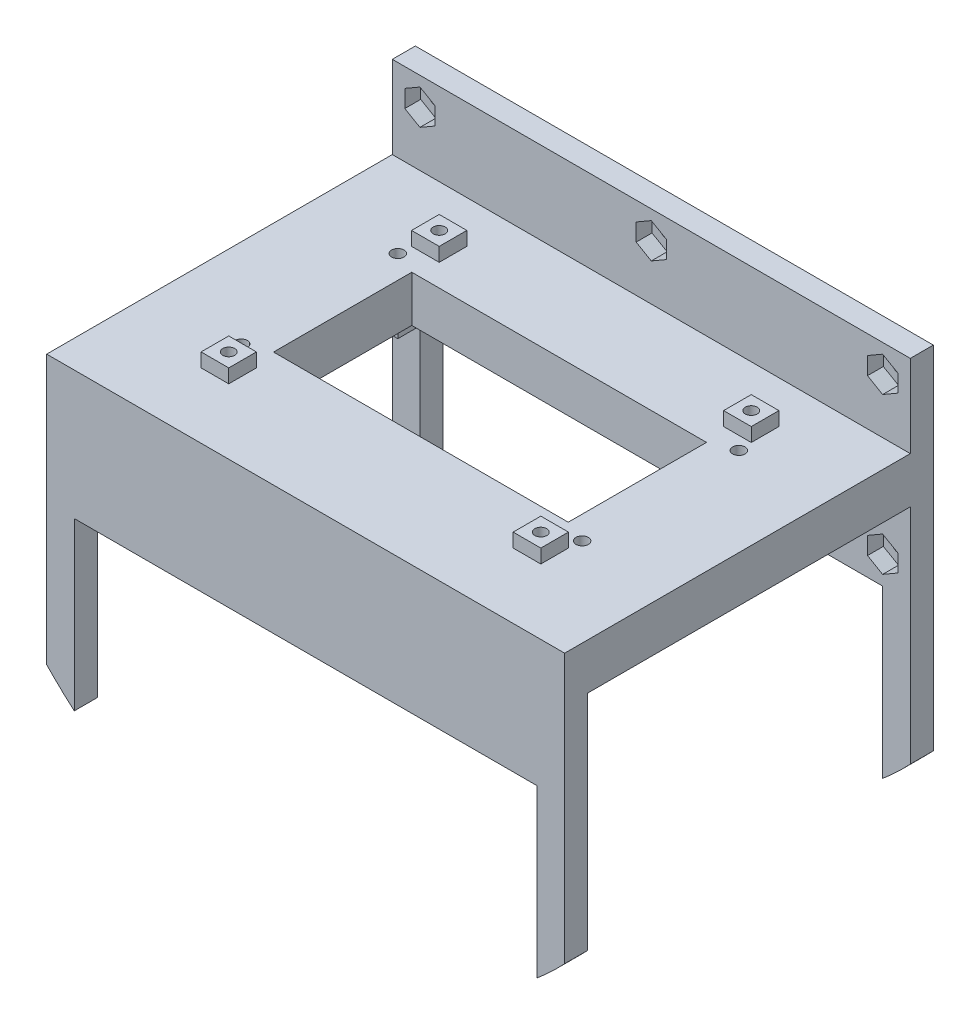
from build123d import *

# Parameters (mm, degrees)
SKETCH1_R               = 1.89865
BOSS_EXTRUDE1_DEPTH     = 6.35
SKETCH2_W               = 142.748
SKETCH2_H               = 12.7
BOSS_EXTRUDE2_DEPTH     = 88.9
SKETCH3_W               = 7.62
SKETCH3_H               = 7.62
SKETCH3_R               = 1.69999914
BOSS_EXTRUDE3_DEPTH     = 3.81
CUT_EXTRUDE2_REACH      = 139.396
SKETCH4_R               = 1.69999914
SKETCH4_W               = 81.221287992
SKETCH4_H               = 38.1
SKETCH5_W               = 7.62
SKETCH5_H               = 7.62
SKETCH5_R               = 1.65
BOSS_EXTRUDE4_DEPTH     = 3.81
BOSS_EXTRUDE5_DEPTH     = 6.35
CUT_EXTRUDE3_DEPTH      = 149.43301976
CUT_EXTRUDE3_DEPTH_BACK = 149.43301976
SKETCH9_R               = 1.65
CUT_EXTRUDE4_DEPTH      = 4.365625


with BuildPart() as part:
    # Sketch1 → Boss-Extrude1 (new body)
    with BuildSketch(Plane.XY):
        with BuildLine():
            Line((-71.374, -29.0845), (-71.374, -67.773392633))
            ThreePointArc((-71.374, -67.773392633), (-67.660178189, -71.481332615), (-63.754, -74.986052763))
            Line((-63.754, -74.986052763), (-63.754, -29.0845))
            Line((-63.754, -29.0845), (63.754, -29.0845))
            Line((63.754, -29.0845), (63.754, -74.986052763))
            ThreePointArc((63.754, -74.986052763), (67.660178189, -71.481332615), (71.374, -67.773392633))
            Line((71.374, -67.773392633), (71.374, -29.0845))
            Line((71.374, -29.0845), (71.374, 29.0845))
            Line((71.374, 29.0845), (-71.374, 29.0845))
            Line((-71.374, 29.0845), (-71.374, -29.0845))
        make_face()
        with Locations((-63.754, 21.4645)):
            Circle(SKETCH1_R, mode=Mode.SUBTRACT)
        with Locations((0, 21.4645)):
            Circle(SKETCH1_R, mode=Mode.SUBTRACT)
        with Locations((63.754, 21.4645)):
            Circle(SKETCH1_R, mode=Mode.SUBTRACT)
        with Locations((63.754, -21.4645)):
            Circle(SKETCH1_R, mode=Mode.SUBTRACT)
        with Locations((0, -21.4645)):
            Circle(SKETCH1_R, mode=Mode.SUBTRACT)
        with Locations((-63.754, -21.4645)):
            Circle(SKETCH1_R, mode=Mode.SUBTRACT)
    extrude(amount=BOSS_EXTRUDE1_DEPTH)

    # Sketch2 → Boss-Extrude2 (add)
    with BuildSketch(Plane.XY.offset(6.35)):
        Rectangle(SKETCH2_W, SKETCH2_H)
    extrude(amount=BOSS_EXTRUDE2_DEPTH)

    # Sketch3 → Boss-Extrude3 (add)
    # profile 1 of 4: a face of its own
    with BuildSketch(Plane.XZ.offset(6.35)):
        with Locations((-46.99, 72.39)):
            Rectangle(SKETCH3_W, SKETCH3_H)
        with Locations(Location((-46.99, 72.39, 0), (0, 0, 90))):
            Circle(SKETCH3_R, mode=Mode.SUBTRACT)
    # profile 2 of 4: a face of its own
    with BuildSketch(Plane.XZ.offset(6.35)):
        with Locations((46.99, 72.39)):
            Rectangle(SKETCH3_W, SKETCH3_H)
        with Locations(Location((46.99, 72.39, 0), (0, 0, 90))):
            Circle(SKETCH3_R, mode=Mode.SUBTRACT)
    # profile 3 of 4: a face of its own
    with BuildSketch(Plane.XZ.offset(6.35)):
        with Locations((46.99, 29.21)):
            Rectangle(SKETCH3_W, SKETCH3_H)
        with Locations(Location((46.99, 29.21, 0), (0, 0, 90))):
            Circle(SKETCH3_R, mode=Mode.SUBTRACT)
    # profile 4 of 4: a face of its own
    with BuildSketch(Plane.XZ.offset(6.35)):
        with Locations((-46.99, 29.21)):
            Rectangle(SKETCH3_W, SKETCH3_H)
        with Locations(Location((-46.99, 29.21, 0), (0, 0, 90))):
            Circle(SKETCH3_R, mode=Mode.SUBTRACT)
    extrude(amount=BOSS_EXTRUDE3_DEPTH)

    # Sketch4 → Cut-Extrude2 (cut, up to next)
    with BuildSketch(Plane.XZ.offset(6.35), mode=Mode.PRIVATE) as cut_extrude2_sk1:
        with Locations(Location((-46.99, 29.21, 0), (0, 0, 90))):
            Circle(SKETCH4_R)
    cut_extrude2_tool1 = extrude(cut_extrude2_sk1.sketch, amount=-CUT_EXTRUDE2_REACH, mode=Mode.PRIVATE) & part.part
    # Sketch4 → Cut-Extrude2 (cut, up to next)
    with BuildSketch(Plane.XZ.offset(6.35), mode=Mode.PRIVATE) as cut_extrude2_sk2:
        with Locations(Location((-46.99, 72.39, 0), (0, 0, 90))):
            Circle(SKETCH4_R)
    cut_extrude2_tool2 = extrude(cut_extrude2_sk2.sketch, amount=-CUT_EXTRUDE2_REACH, mode=Mode.PRIVATE) & part.part
    # Sketch4 → Cut-Extrude2 (cut, up to next)
    with BuildSketch(Plane.XZ.offset(6.35), mode=Mode.PRIVATE) as cut_extrude2_sk3:
        with Locations(Location((46.99, 29.21, 0), (0, 0, 90))):
            Circle(SKETCH4_R)
    cut_extrude2_tool3 = extrude(cut_extrude2_sk3.sketch, amount=-CUT_EXTRUDE2_REACH, mode=Mode.PRIVATE) & part.part
    # Sketch4 → Cut-Extrude2 (cut, up to next)
    with BuildSketch(Plane.XZ.offset(6.35), mode=Mode.PRIVATE) as cut_extrude2_sk4:
        with Locations(Location((46.99, 72.39, 0), (0, 0, 90))):
            Circle(SKETCH4_R)
    cut_extrude2_tool4 = extrude(cut_extrude2_sk4.sketch, amount=-CUT_EXTRUDE2_REACH, mode=Mode.PRIVATE) & part.part
    # Sketch4 → Cut-Extrude2 (cut, up to next)
    with BuildSketch(Plane.XZ.offset(6.35), mode=Mode.PRIVATE) as cut_extrude2_sk5:
        with Locations((0, 50.8)):
            Rectangle(SKETCH4_W, SKETCH4_H)
    cut_extrude2_tool5 = extrude(cut_extrude2_sk5.sketch, amount=-CUT_EXTRUDE2_REACH, mode=Mode.PRIVATE) & part.part
    add(cut_extrude2_tool1.solids().sort_by_distance((-46.99, -6.35, 29.21))[0], mode=Mode.SUBTRACT)
    add(cut_extrude2_tool2.solids().sort_by_distance((-46.99, -6.35, 72.39))[0], mode=Mode.SUBTRACT)
    add(cut_extrude2_tool3.solids().sort_by_distance((46.99, -6.35, 29.21))[0], mode=Mode.SUBTRACT)
    add(cut_extrude2_tool4.solids().sort_by_distance((46.99, -6.35, 72.39))[0], mode=Mode.SUBTRACT)
    add(cut_extrude2_tool5.solids().sort_by_distance((0, -6.35, 50.8))[0], mode=Mode.SUBTRACT)

    # Sketch5 → Boss-Extrude4 (add)
    # profile 1 of 4: a face of its own
    with BuildSketch(Plane(origin=(0, 6.35, 0), x_dir=(1, 0, 0), z_dir=(0, 1, 0))):
        with Locations((-43, -21.8)):
            Rectangle(SKETCH5_W, SKETCH5_H)
        with Locations(Location((-43, -21.8, 0), (0, 0, 90))):
            Circle(SKETCH5_R, mode=Mode.SUBTRACT)
    # profile 2 of 4: a face of its own
    with BuildSketch(Plane(origin=(0, 6.35, 0), x_dir=(1, 0, 0), z_dir=(0, 1, 0))):
        with Locations((43, -21.8)):
            Rectangle(SKETCH5_W, SKETCH5_H)
        with Locations(Location((43, -21.8, 0), (0, 0, 90))):
            Circle(SKETCH5_R, mode=Mode.SUBTRACT)
    # profile 3 of 4: a face of its own
    with BuildSketch(Plane(origin=(0, 6.35, 0), x_dir=(1, 0, 0), z_dir=(0, 1, 0))):
        with Locations((43, -79.8)):
            Rectangle(SKETCH5_W, SKETCH5_H)
        with Locations(Location((43, -79.8, 0), (0, 0, 90))):
            Circle(SKETCH5_R, mode=Mode.SUBTRACT)
    # profile 4 of 4: a face of its own
    with BuildSketch(Plane(origin=(0, 6.35, 0), x_dir=(1, 0, 0), z_dir=(0, 1, 0))):
        with Locations((-43, -79.8)):
            Rectangle(SKETCH5_W, SKETCH5_H)
        with Locations(Location((-43, -79.8, 0), (0, 0, 90))):
            Circle(SKETCH5_R, mode=Mode.SUBTRACT)
    extrude(amount=BOSS_EXTRUDE4_DEPTH)

    # Sketch6 → Boss-Extrude5 (add)
    with BuildSketch(Plane.XY.offset(95.25)):
        with BuildLine():
            Line((-71.374, 6.35), (71.374, 6.35))
            Line((71.374, 6.35), (71.374, -6.35))
            Line((71.374, -6.35), (71.374, -67.773392633))
            ThreePointArc((71.374, -67.773392633), (67.660178189, -71.481332615), (63.754, -74.986052763))
            Line((63.754, -74.986052763), (63.754, -29.0845))
            Line((63.754, -29.0845), (-63.754, -29.0845))
            Line((-63.754, -29.0845), (-63.754, -74.986052763))
            ThreePointArc((-63.754, -74.986052763), (-67.660178189, -71.481332615), (-71.374, -67.773392633))
            Line((-71.374, -67.773392633), (-71.374, -6.35))
            Line((-71.374, -6.35), (-71.374, 6.35))
        make_face()
    extrude(amount=BOSS_EXTRUDE5_DEPTH)

    # Sketch9 → Cut-Extrude3 (cut, two sides: drawn at the far end of the back side and taken through both)
    with BuildSketch(Plane(origin=(0, 6.35, 0), x_dir=(1, 0, 0), z_dir=(0, 1, 0)).offset(-CUT_EXTRUDE3_DEPTH_BACK)):
        with Locations(Location((-43, -21.8, 0), (0, 0, 90))):
            Circle(SKETCH9_R)
        with Locations(Location((43, -21.8, 0), (0, 0, 90))):
            Circle(SKETCH9_R)
        with Locations(Location((-43, -79.8, 0), (0, 0, 90))):
            Circle(SKETCH9_R)
        with Locations(Location((43, -79.8, 0), (0, 0, 90))):
            Circle(SKETCH9_R)
    extrude(amount=CUT_EXTRUDE3_DEPTH + CUT_EXTRUDE3_DEPTH_BACK, mode=Mode.SUBTRACT)

    # Sketch10 → Cut-Extrude4 (cut)
    with BuildSketch(Plane.XY.offset(6.35)):
        Polygon((4.16875, 19.057671065), (4.16875, 23.871328935), (0, 26.278157869), (-4.16875, 23.871328935), (-4.16875, 19.057671065), (0, 16.650842131), align=None)
        Polygon((0, -16.650842131), (4.16875, -19.057671065), (4.16875, -23.871328935), (0, -26.278157869), (-4.16875, -23.871328935), (-4.16875, -19.057671065), align=None)
        Polygon((-59.58525, -19.057671065), (-63.754, -16.650842131), (-67.92275, -19.057671065), (-67.92275, -23.871328935), (-63.754, -26.278157869), (-59.58525, -23.871328935), align=None)
        Polygon((-63.754, 16.650842131), (-67.92275, 19.057671065), (-67.92275, 23.871328935), (-63.754, 26.278157869), (-59.58525, 23.871328935), (-59.58525, 19.057671065), align=None)
        Polygon((59.58525, -23.871328935), (59.58525, -19.057671065), (63.754, -16.650842131), (67.92275, -19.057671065), (67.92275, -23.871328935), (63.754, -26.278157869), align=None)
        Polygon((59.58525, 19.057671065), (63.754, 16.650842131), (67.92275, 19.057671065), (67.92275, 23.871328935), (63.754, 26.278157869), (59.58525, 23.871328935), align=None)
    extrude(amount=-CUT_EXTRUDE4_DEPTH, mode=Mode.SUBTRACT)


solid = part.part
